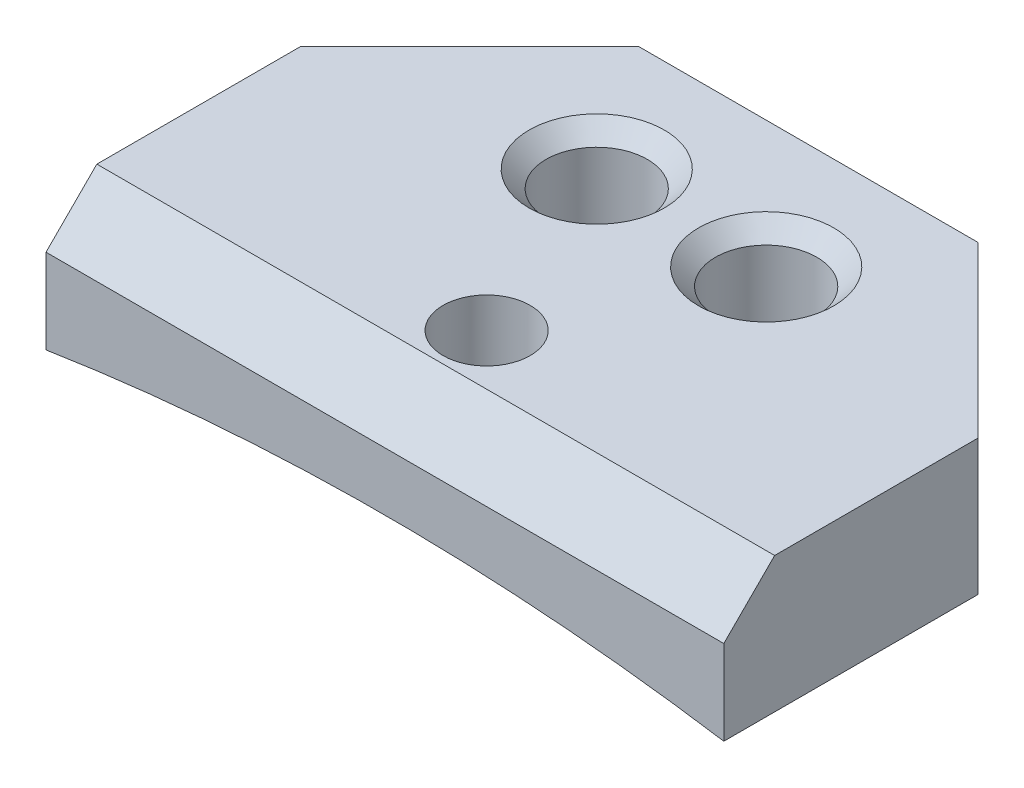
from build123d import *

# Parameters (mm, degrees)
BOSS_EXTRUDE1_DEPTH              = 3.175
CUT_EXTRUDE1_DEPTH               = 30.765898876
CUT_EXTRUDE1_DEPTH_BACK          = 30.765898876
SKETCH2_R                        = 83.82
BOSS_EXTRUDE2_DEPTH              = 15.875
CHAMFER1_SIZE                    = 6.35
F_10_24_TAPPED_HOLE1_D           = 3.7973
F_10_24_TAPPED_HOLE1_CSINK_D     = 5.0673
F_10_24_TAPPED_HOLE1_CSINK_ANGLE = 90
CHAMFER2_SIZE                    = 1.905
SKETCH6_R                        = 1.63195
CUT_EXTRUDE2_DEPTH               = 36.477207644


with BuildPart() as part:
    # Sketch1 → Boss-Extrude1 (new body)
    with BuildSketch(Plane(origin=(0, 0, 0), x_dir=(1, 0, 0), z_dir=(0, 1, 0))):
        Polygon((-28.511825699, -10.967228887), (-22.161825699, -4.617228887), (-9.461825699, -4.617228887), (-3.111825699, -10.967228887), (-3.111825699, -12.554728887), (-28.511825699, -12.554728887), align=None)
    extrude(amount=BOSS_EXTRUDE1_DEPTH)

    # Sketch2 → Cut-Extrude1 (cut, two sides: drawn at the far end of the back side and taken through both)
    with BuildSketch(Plane.XY.offset(12.554728887).offset(-CUT_EXTRUDE1_DEPTH_BACK)):
        with Locations((-15.811825699, -82.852292666)):
            Circle(SKETCH2_R)
    extrude(amount=CUT_EXTRUDE1_DEPTH + CUT_EXTRUDE1_DEPTH_BACK, mode=Mode.SUBTRACT)

    # Sketch5 → Boss-Extrude2 (add)
    with BuildSketch(Plane(origin=(0, 0, 4.617228887), x_dir=(-1, 0, 0), z_dir=(0, 0, -1))):
        with BuildLine():
            Line((3.111825699, 3.175), (3.111825699, 0))
            Line((3.111825699, 0), (3.111825699, -1.902066279))
            ThreePointArc((3.111825699, -1.902066279), (15.811825699, -0.911892666), (28.511825699, -1.902066279))
            Line((28.511825699, -1.902066279), (28.511825699, 0))
            Line((28.511825699, 0), (28.511825699, 3.175))
            Line((28.511825699, 3.175), (3.111825699, 3.175))
        make_face()
    extrude(amount=-BOSS_EXTRUDE2_DEPTH)

    # Chamfer1
    chamfer1_edges = [part.edges().sort_by_distance(p)[0] for p in [
        (-3.111825699, 0.636466861, 4.617228887),
        (-28.511825699, 0.636466861, 4.617228887),
    ]]
    chamfer(chamfer1_edges, length=CHAMFER1_SIZE)

    # #10-24 Tapped Hole1 (through all)
    with Locations(Plane(origin=(0, 3.175, 0), x_dir=(1, 0, 0), z_dir=(0, 1, 0))):
        with Locations((-18.986825699, -9.379728887), (-12.636825699, -9.379728887)):
            CounterSinkHole(F_10_24_TAPPED_HOLE1_D / 2, F_10_24_TAPPED_HOLE1_CSINK_D / 2, counter_sink_angle=F_10_24_TAPPED_HOLE1_CSINK_ANGLE)

    # Chamfer2
    chamfer2_edges = [part.edges().sort_by_distance(p)[0] for p in [
        (-15.811825699, 3.175, 20.492228887),
    ]]
    chamfer(chamfer2_edges, length=CHAMFER2_SIZE)

    # Sketch6 → Cut-Extrude2 (cut, through all)
    with BuildSketch(Plane(origin=(0, 3.175, 0), x_dir=(1, 0, 0), z_dir=(0, 1, 0))):
        with Locations(Location((-15.81004542, -16.682228887, 0), (0, 0, 270))):
            Circle(SKETCH6_R)
    extrude(amount=-CUT_EXTRUDE2_DEPTH, mode=Mode.SUBTRACT)


solid = part.part
